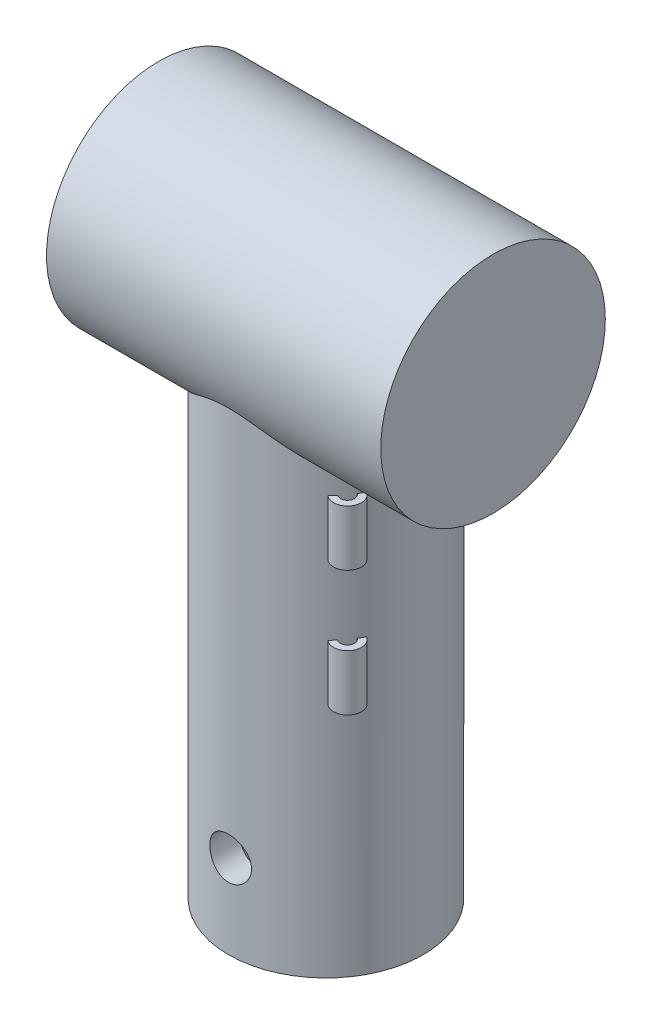
from build123d import *

# Parameters (mm, degrees)
SKETCH_1_R               = 7
EXTRUDE_1_DEPTH          = 4
SKETCH_2_R               = 7
EXTRUDE_2_DEPTH          = 30
SKETCH_4_R               = 1
SKETCH_4_R_2             = 0.5
EXTRUDE_3_DEPTH          = 8
EXTRUDE_4_DEPTH          = 4
CUT_EXTRUDE_1_DEPTH      = 4
EXTRUDE_5_DEPTH          = 12
EXTRUDE_5_DEPTH_BACK     = 12
SKETCH_9_R               = 8.062257748
SKETCH_12_R              = 5
CUT_EXTRUDE_2_DEPTH      = 10
CUT_EXTRUDE_3_DEPTH      = 49.277651166
CUT_EXTRUDE_3_DEPTH_BACK = 49.277651166
SKETCH_13_R              = 1.5


with BuildPart() as part:
    # 草图1 → 凸台-拉伸1 (new body)
    with BuildSketch(Plane(origin=(0, 0, 0), x_dir=(1, 0, 0), z_dir=(0, 1, 0))):
        with Locations(Location((0, 0, 0), (0, 0, 270))):
            Circle(SKETCH_1_R)
    extrude(amount=EXTRUDE_1_DEPTH)

    # 草图2 → 凸台-拉伸2 (add)
    with BuildSketch(Plane(origin=(0, 4, 0), x_dir=(1, 0, 0), z_dir=(0, 1, 0))):
        with Locations(Location((0, 0, 0), (0, 0, 270))):
            Circle(SKETCH_2_R)
    extrude(amount=EXTRUDE_2_DEPTH)

    # 草图4 → 凸台-拉伸3 (add)
    with BuildSketch(Plane(origin=(0, 34, 0), x_dir=(1, 0, 0), z_dir=(0, 1, 0))):
        with Locations((5.663466382, -4.114018539)):
            Circle(SKETCH_4_R)
        with Locations((5.663466382, -4.114018539)):
            Circle(SKETCH_4_R_2, mode=Mode.SUBTRACT)
    extrude(amount=-EXTRUDE_3_DEPTH)

    # 草图5 → 凸台-拉伸4 (add)
    with BuildSketch(Plane(origin=(0, 21, 0), x_dir=(-1, 0, 0), z_dir=(0, -1, 0))):
        with BuildLine():
            ThreePointArc((-5.355347766, -4.507798831), (-5.190723909, -4.696422606), (-5.01946017, -4.879038799))
            ThreePointArc((-5.01946017, -4.879038799), (-6.472533008, -4.701735473), (-6.191891648, -3.265038717))
            ThreePointArc((-6.191891648, -3.265038717), (-6.071173774, -3.484372111), (-5.942689761, -3.699248356))
            ThreePointArc((-5.942689761, -3.699248356), (-6.067999695, -4.407877006), (-5.355347766, -4.507798831))
        make_face()
    extrude(amount=EXTRUDE_4_DEPTH)

    # 草图10 → 切除-拉伸1 (cut)
    with BuildSketch(Plane(origin=(0, 34, 0), x_dir=(1, 0, 0), z_dir=(0, 1, 0))):
        with BuildLine():
            ThreePointArc((5.355347766, -4.507798831), (6.067999695, -4.407877006), (5.942689761, -3.699248356))
            ThreePointArc((5.942689761, -3.699248356), (6.071173774, -3.484372111), (6.191891648, -3.265038717))
            ThreePointArc((6.191891648, -3.265038717), (6.472533008, -4.701735473), (5.01946017, -4.879038799))
            ThreePointArc((5.01946017, -4.879038799), (5.190723909, -4.696422606), (5.355347766, -4.507798831))
        make_face()
    extrude(amount=-CUT_EXTRUDE_1_DEPTH, mode=Mode.SUBTRACT)

    # 草图9 → 凸台-拉伸5 (add, two sides: drawn at the far end of the back side and taken through both)
    with BuildSketch(Plane(origin=(0, 0, 0), x_dir=(0, 0, -1), z_dir=(1, 0, 0)).offset(-EXTRUDE_5_DEPTH_BACK)):
        with Locations((0, 38)):
            Circle(SKETCH_9_R)
    extrude(amount=EXTRUDE_5_DEPTH + EXTRUDE_5_DEPTH_BACK)

    # 草图12 → 切除-拉伸2 (cut)
    with BuildSketch(Plane.XZ):
        with Locations(Location((0, 0, 0), (0, 0, 270))):
            Circle(SKETCH_12_R)
    extrude(amount=-CUT_EXTRUDE_2_DEPTH, mode=Mode.SUBTRACT)

    # 草图13 → 切除-拉伸3 (cut, two sides: drawn at the far end of the back side and taken through both)
    with BuildSketch(Plane.XY.offset(-CUT_EXTRUDE_3_DEPTH_BACK)):
        with Locations((0, 6)):
            Circle(SKETCH_13_R)
    extrude(amount=CUT_EXTRUDE_3_DEPTH + CUT_EXTRUDE_3_DEPTH_BACK, mode=Mode.SUBTRACT)


solid = part.part
